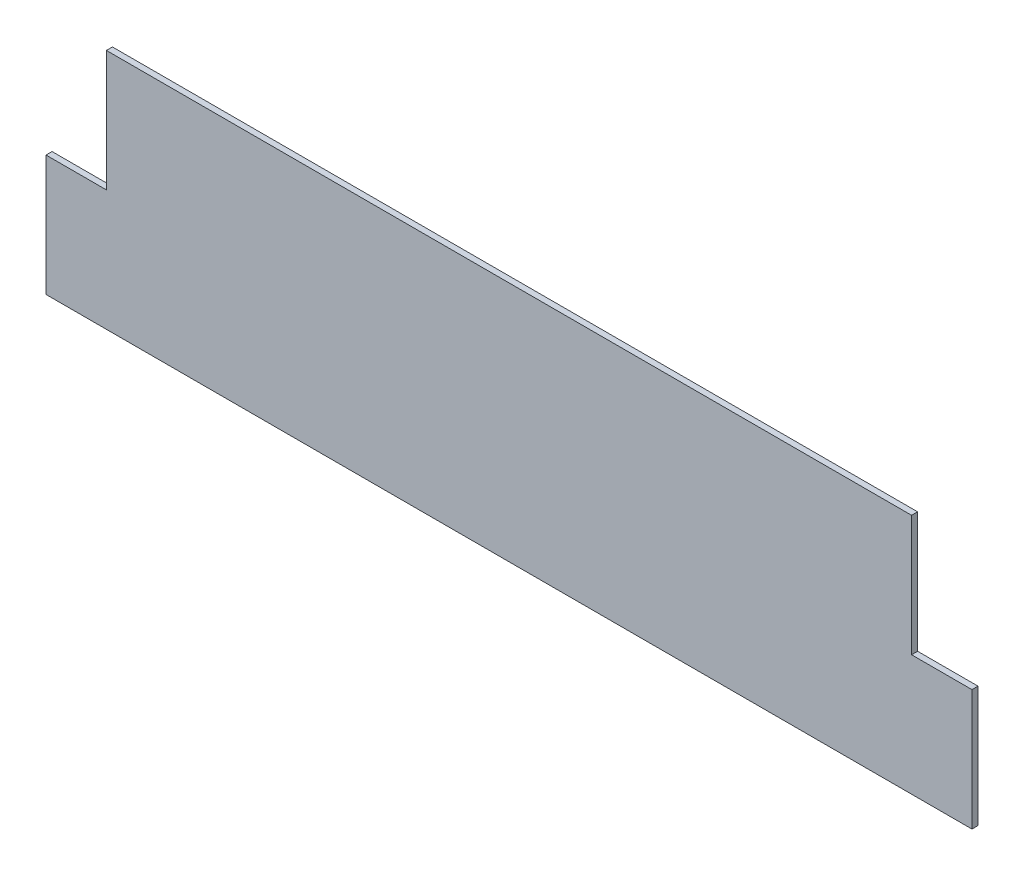
from build123d import *

# Parameters (mm, degrees)
P_IDAT_VYSUNUT_M1_DEPTH = 3


with BuildPart() as part:
    # Skica1 → Přidat vysunutím1 (new body)
    with BuildSketch(Plane.XY):
        Polygon((-170.212864542, 0), (289.787135458, 0), (289.787135458, 60), (259.787135458, 60), (259.787135458, 120), (-140.212864542, 120), (-140.212864542, 60), (-170.212864542, 60), align=None)
    extrude(amount=P_IDAT_VYSUNUT_M1_DEPTH)


solid = part.part
